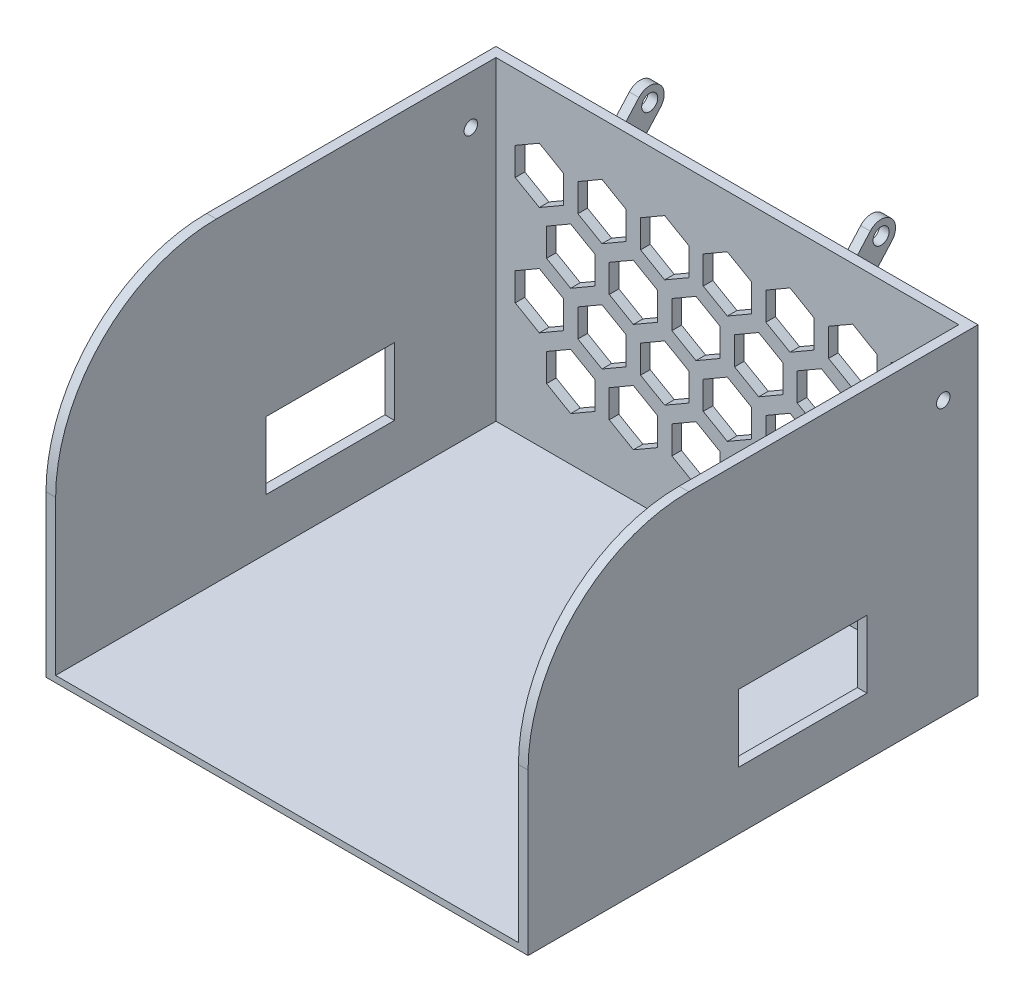
from build123d import *

# Parameters (mm, degrees)
BOSS_EXTRUDE1_DEPTH = 150
SKETCH2_W           = 144
SKETCH2_H           = 142
CUT_EXTRUDE1_DEPTH  = 98
SKETCH3_R           = 2.5
BOSS_EXTRUDE2_DEPTH = 1.5
CUT_EXTRUDE2_REACH  = 232.937
SKETCH4_R           = 2.1
SKETCH4_W           = 40
SKETCH4_H           = 21
CUT_EXTRUDE3_DEPTH  = 10


with BuildPart() as part:
    # Sketch1 → Boss-Extrude1 (new body)
    with BuildSketch(Plane(origin=(0, 0, 0), x_dir=(0, 0, -1), z_dir=(1, 0, 0))):
        with BuildLine():
            Line((0, 0), (-140, 0))
            Line((-140, 0), (-140, 50))
            ThreePointArc((-140, 50), (-125.355339059, 85.355339059), (-90, 100))
            Line((-90, 100), (0, 100))
            Line((0, 100), (0, 0))
        make_face()
    extrude(amount=BOSS_EXTRUDE1_DEPTH)

    # Sketch2 → Cut-Extrude1 (cut)
    with BuildSketch(Plane(origin=(0, 100, 0), x_dir=(1, 0, 0), z_dir=(0, 1, 0))):
        with Locations((75, -74)):
            Rectangle(SKETCH2_W, SKETCH2_H)
    extrude(amount=-CUT_EXTRUDE1_DEPTH, mode=Mode.SUBTRACT)

    # Sketch3 → Boss-Extrude2 (add, symmetric)
    with BuildSketch(Plane(origin=(111, 0, 0), x_dir=(0, 0, -1), z_dir=(1, 0, 0))):
        with BuildLine():
            Line((0, 100), (0, 86.483689179))
            Line((0, 86.483689179), (10.709846007, 98.483689179))
            ThreePointArc((10.709846007, 98.483689179), (10.348889249, 104.837405432), (3.995172996, 104.476448674))
            Line((3.995172996, 104.476448674), (0, 100))
        make_face()
        with Locations((7.352509502, 101.480068927)):
            Circle(SKETCH3_R, mode=Mode.SUBTRACT)
    boss_extrude2 = extrude(amount=BOSS_EXTRUDE2_DEPTH, both=True)

    # Mirror1: Boss-Extrude2 across plane
    add(boss_extrude2.mirror(Plane(origin=(75, 0, 0), x_dir=(0, 0, 1), z_dir=(1, 0, 0))))

    # Sketch4 → Cut-Extrude2 (cut, up to next)
    with BuildSketch(Plane(origin=(150, 0, 0), x_dir=(0, 0, -1), z_dir=(1, 0, 0)), mode=Mode.PRIVATE) as cut_extrude2_sk1:
        with Locations((-10.810728321, 85.063406284)):
            Circle(SKETCH4_R)
    cut_extrude2_tool1 = extrude(cut_extrude2_sk1.sketch, amount=-CUT_EXTRUDE2_REACH, mode=Mode.PRIVATE) & part.part
    # Sketch4 → Cut-Extrude2 (cut, up to next)
    with BuildSketch(Plane(origin=(150, 0, 0), x_dir=(0, 0, -1), z_dir=(1, 0, 0)), mode=Mode.PRIVATE) as cut_extrude2_sk2:
        with Locations((-54.561214212, 28.49486379)):
            Rectangle(SKETCH4_W, SKETCH4_H)
    cut_extrude2_tool2 = extrude(cut_extrude2_sk2.sketch, amount=-CUT_EXTRUDE2_REACH, mode=Mode.PRIVATE) & part.part
    cut_extrude2_1 = cut_extrude2_tool1.solids().sort_by_distance((150, 85.063406, 10.810728))[0]
    add(cut_extrude2_1, mode=Mode.SUBTRACT)
    cut_extrude2_2 = cut_extrude2_tool2.solids().sort_by_distance((150, 28.494864, 54.561214))[0]
    add(cut_extrude2_2, mode=Mode.SUBTRACT)
    cut_extrude2 = cut_extrude2_1 + cut_extrude2_2  # Cut-Extrude2 as one shape, for the pattern or mirror that repeats it

    # Mirror2: Cut-Extrude2 across plane
    add(cut_extrude2.mirror(Plane(origin=(75, 0, 0), x_dir=(0, 0, 1), z_dir=(1, 0, 0))), mode=Mode.SUBTRACT)

    # Sketch5 → Cut-Extrude3 (cut)
    with BuildSketch(Plane(origin=(0, 0, 0), x_dir=(-1, 0, 0), z_dir=(0, 0, -1))):
        Polygon((-114, 83.660254038), (-121.5, 79.330127019), (-121.5, 70.669872981), (-114, 66.339745962), (-106.5, 70.669872981), (-106.5, 79.330127019), align=None)
        Polygon((-133.5, 83.660254038), (-141, 79.330127019), (-141, 70.669872981), (-133.5, 66.339745962), (-126, 70.669872981), (-126, 79.330127019), align=None)
        Polygon((-94.5, 83.660254038), (-102, 79.330127019), (-102, 70.669872981), (-94.5, 66.339745962), (-87, 70.669872981), (-87, 79.330127019), align=None)
        Polygon((-75, 83.660254038), (-82.5, 79.330127019), (-82.5, 70.669872981), (-75, 66.339745962), (-67.5, 70.669872981), (-67.5, 79.330127019), align=None)
        Polygon((-55.5, 83.660254038), (-63, 79.330127019), (-63, 70.669872981), (-55.5, 66.339745962), (-48, 70.669872981), (-48, 79.330127019), align=None)
        Polygon((-36, 83.660254038), (-43.5, 79.330127019), (-43.5, 70.669872981), (-36, 66.339745962), (-28.5, 70.669872981), (-28.5, 79.330127019), align=None)
        Polygon((-16.5, 83.660254038), (-24, 79.330127019), (-24, 70.669872981), (-16.5, 66.339745962), (-9, 70.669872981), (-9, 79.330127019), align=None)
        Polygon((-123.75, 66.772758664), (-131.25, 62.442631645), (-131.25, 53.782377607), (-123.75, 49.452250588), (-116.25, 53.782377607), (-116.25, 62.442631645), align=None)
        Polygon((-104.25, 66.772758664), (-111.75, 62.442631645), (-111.75, 53.782377607), (-104.25, 49.452250588), (-96.75, 53.782377607), (-96.75, 62.442631645), align=None)
        Polygon((-84.75, 66.772758664), (-92.25, 62.442631645), (-92.25, 53.782377607), (-84.75, 49.452250588), (-77.25, 53.782377607), (-77.25, 62.442631645), align=None)
        Polygon((-65.25, 66.772758664), (-72.75, 62.442631645), (-72.75, 53.782377607), (-65.25, 49.452250588), (-57.75, 53.782377607), (-57.75, 62.442631645), align=None)
        Polygon((-45.75, 66.772758664), (-53.25, 62.442631645), (-53.25, 53.782377607), (-45.75, 49.452250588), (-38.25, 53.782377607), (-38.25, 62.442631645), align=None)
        Polygon((-26.25, 66.772758664), (-33.75, 62.442631645), (-33.75, 53.782377607), (-26.25, 49.452250588), (-18.75, 53.782377607), (-18.75, 62.442631645), align=None)
        Polygon((-9, 36.894882233), (-16.5, 32.564755215), (-24, 36.894882233), (-24, 45.555136271), (-16.5, 49.88526329), (-9, 45.555136271), align=None)
        Polygon((-28.5, 36.894882233), (-36, 32.564755215), (-43.5, 36.894882233), (-43.5, 45.555136271), (-36, 49.88526329), (-28.5, 45.555136271), align=None)
        Polygon((-48, 36.894882233), (-55.5, 32.564755215), (-63, 36.894882233), (-63, 45.555136271), (-55.5, 49.88526329), (-48, 45.555136271), align=None)
        Polygon((-67.5, 36.894882233), (-75, 32.564755215), (-82.5, 36.894882233), (-82.5, 45.555136271), (-75, 49.88526329), (-67.5, 45.555136271), align=None)
        Polygon((-87, 36.894882233), (-94.5, 32.564755215), (-102, 36.894882233), (-102, 45.555136271), (-94.5, 49.88526329), (-87, 45.555136271), align=None)
        Polygon((-106.5, 36.894882233), (-114, 32.564755215), (-121.5, 36.894882233), (-121.5, 45.555136271), (-114, 49.88526329), (-106.5, 45.555136271), align=None)
        Polygon((-126, 36.894882233), (-133.5, 32.564755215), (-141, 36.894882233), (-141, 45.555136271), (-133.5, 49.88526329), (-126, 45.555136271), align=None)
        Polygon((-18.75, 20.00738686), (-26.25, 15.677259841), (-33.75, 20.00738686), (-33.75, 28.667640898), (-26.25, 32.997767916), (-18.75, 28.667640898), align=None)
        Polygon((-38.25, 20.00738686), (-45.75, 15.677259841), (-53.25, 20.00738686), (-53.25, 28.667640898), (-45.75, 32.997767916), (-38.25, 28.667640898), align=None)
        Polygon((-57.75, 20.00738686), (-65.25, 15.677259841), (-72.75, 20.00738686), (-72.75, 28.667640898), (-65.25, 32.997767916), (-57.75, 28.667640898), align=None)
        Polygon((-77.25, 20.00738686), (-84.75, 15.677259841), (-92.25, 20.00738686), (-92.25, 28.667640898), (-84.75, 32.997767916), (-77.25, 28.667640898), align=None)
        Polygon((-96.75, 20.00738686), (-104.25, 15.677259841), (-111.75, 20.00738686), (-111.75, 28.667640898), (-104.25, 32.997767916), (-96.75, 28.667640898), align=None)
        Polygon((-116.25, 20.00738686), (-123.75, 15.677259841), (-131.25, 20.00738686), (-131.25, 28.667640898), (-123.75, 32.997767916), (-116.25, 28.667640898), align=None)
    extrude(amount=-CUT_EXTRUDE3_DEPTH, mode=Mode.SUBTRACT)


solid = part.part
